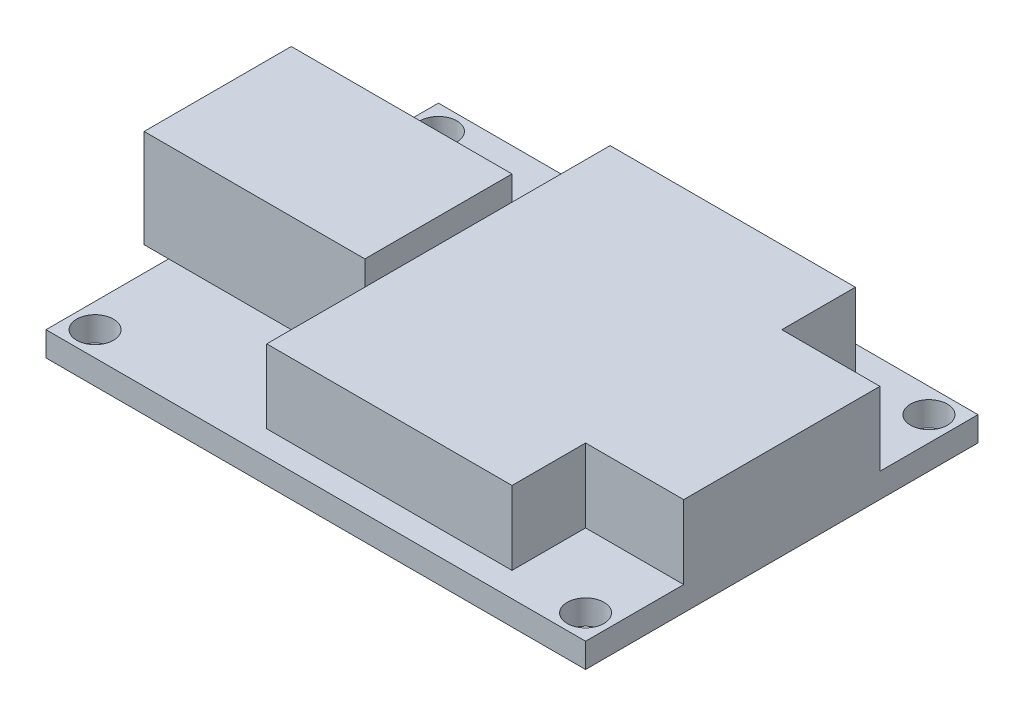
from build123d import *

# Parameters (mm, degrees)
SKETCH1_W           = 34.925
SKETCH1_H           = 25.4
BOSS_EXTRUDE1_DEPTH = 1.5875
BOSS_EXTRUDE2_DEPTH = 4.7625
SKETCH4_W           = 14.2875
SKETCH4_H           = 9.525
BOSS_EXTRUDE7_DEPTH = 6.35
SKETCH6_R           = 1.190625
CUT_EXTRUDE1_DEPTH  = 24.759524406


with BuildPart() as part:
    # Sketch1 → Boss-Extrude1 (new body)
    with BuildSketch(Plane(origin=(0, 0, 0), x_dir=(1, 0, 0), z_dir=(0, 1, 0))):
        Rectangle(SKETCH1_W, SKETCH1_H)
    extrude(amount=BOSS_EXTRUDE1_DEPTH)

    # Sketch2 → Boss-Extrude2 (add)
    with BuildSketch(Plane(origin=(0, 1.5875, 0), x_dir=(1, 0, 0), z_dir=(0, 1, 0))):
        Polygon((-4.7625, 11.1125), (11.1125, 11.1125), (11.1125, 6.35), (17.4625, 6.35), (17.4625, -6.35), (11.1125, -6.35), (11.1125, -11.1125), (-4.7625, -11.1125), align=None)
    extrude(amount=BOSS_EXTRUDE2_DEPTH)

    # Sketch4 → Boss-Extrude7 (add)
    with BuildSketch(Plane(origin=(0, 1.5875, 0), x_dir=(1, 0, 0), z_dir=(0, 1, 0))):
        with Locations((-11.90625, 0)):
            Rectangle(SKETCH4_W, SKETCH4_H)
    extrude(amount=BOSS_EXTRUDE7_DEPTH)

    # Sketch6 → Cut-Extrude1 (cut, through all)
    with BuildSketch(Plane(origin=(0, 1.5875, 0), x_dir=(1, 0, 0), z_dir=(0, 1, 0))):
        with Locations(Location((-15.875, 11.1125, 0), (0, 0, 270))):
            Circle(SKETCH6_R)
        with Locations(Location((-15.875, -11.1125, 0), (0, 0, 270))):
            Circle(SKETCH6_R)
        with Locations(Location((15.875, -11.1125, 0), (0, 0, 270))):
            Circle(SKETCH6_R)
        with Locations(Location((15.875, 11.1125, 0), (0, 0, 270))):
            Circle(SKETCH6_R)
    extrude(amount=-CUT_EXTRUDE1_DEPTH, mode=Mode.SUBTRACT)


solid = part.part
